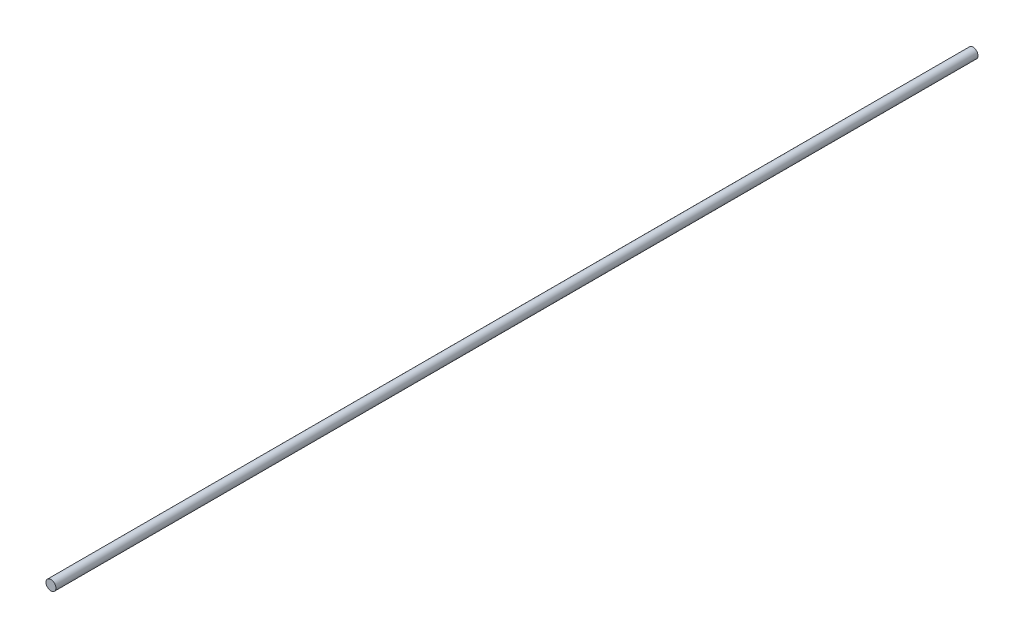
from build123d import *

# Parameters (mm, degrees)
SKETCH1_R           = 6.35
BOSS_EXTRUDE1_DEPTH = 1178.306


with BuildPart() as part:
    # Sketch1 → Boss-Extrude1 (new body)
    with BuildSketch(Plane.XY):
        Circle(SKETCH1_R)
    extrude(amount=-BOSS_EXTRUDE1_DEPTH)


solid = part.part
